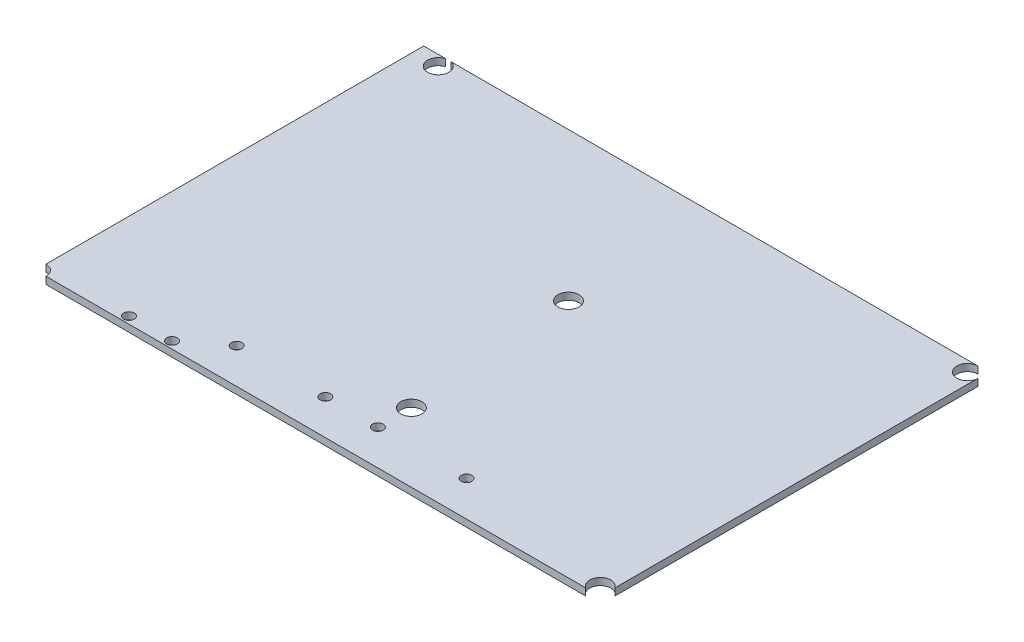
from build123d import *

# Parameters (mm, degrees)
IZIM1_R                     = 3
IZIM1_R_2                   = 1.5
Y_KSEKLIK_EKSTR_ZYON1_DEPTH = 2


with BuildPart() as part:
    # Çizim1 → Yükseklik-Ekstrüzyon1 (new body)
    with BuildSketch(Plane(origin=(0, 0, 0), x_dir=(1, 0, 0), z_dir=(0, 1, 0))):
        with BuildLine():
            Line((-80, 55), (-73.768114575, 55))
            ThreePointArc((-73.768114575, 55), (-73, 49.1), (-72.231885425, 55))
            Line((-72.231885425, 55), (77, 55))
            ThreePointArc((77, 55), (74.878679656, 49.878679656), (80, 52))
            Line((80, 52), (80, -50.841687605))
            ThreePointArc((80, -50.841687605), (75.378679656, -50.378679656), (75.841687605, -55))
            Line((75.841687605, -55), (-77, -55))
            ThreePointArc((-77, -55), (-77.878679656, -52.878679656), (-80, -52))
            Line((-80, -52), (-80, 55))
        make_face()
        with Locations(Location((7, -35.5, 0), (0, 0, 270))):
            Circle(IZIM1_R, mode=Mode.SUBTRACT)
        with Locations(Location((3, 13, 0), (0, 0, 270))):
            Circle(IZIM1_R, mode=Mode.SUBTRACT)
        with Locations(Location((-33, -45, 0), (0, 0, 270))):
            Circle(IZIM1_R_2, mode=Mode.SUBTRACT)
        with Locations(Location((-7.88, -45, 0), (0, 0, 270))):
            Circle(IZIM1_R_2, mode=Mode.SUBTRACT)
        with Locations(Location((7, -45, 0), (0, 0, 270))):
            Circle(IZIM1_R_2, mode=Mode.SUBTRACT)
        with Locations(Location((32.12, -45, 0), (0, 0, 270))):
            Circle(IZIM1_R_2, mode=Mode.SUBTRACT)
        with Locations(Location((-55.5, -53, 0), (0, 0, 270))):
            Circle(IZIM1_R_2, mode=Mode.SUBTRACT)
        with Locations(Location((-43.3, -53, 0), (0, 0, 270))):
            Circle(IZIM1_R_2, mode=Mode.SUBTRACT)
    extrude(amount=Y_KSEKLIK_EKSTR_ZYON1_DEPTH)


solid = part.part
